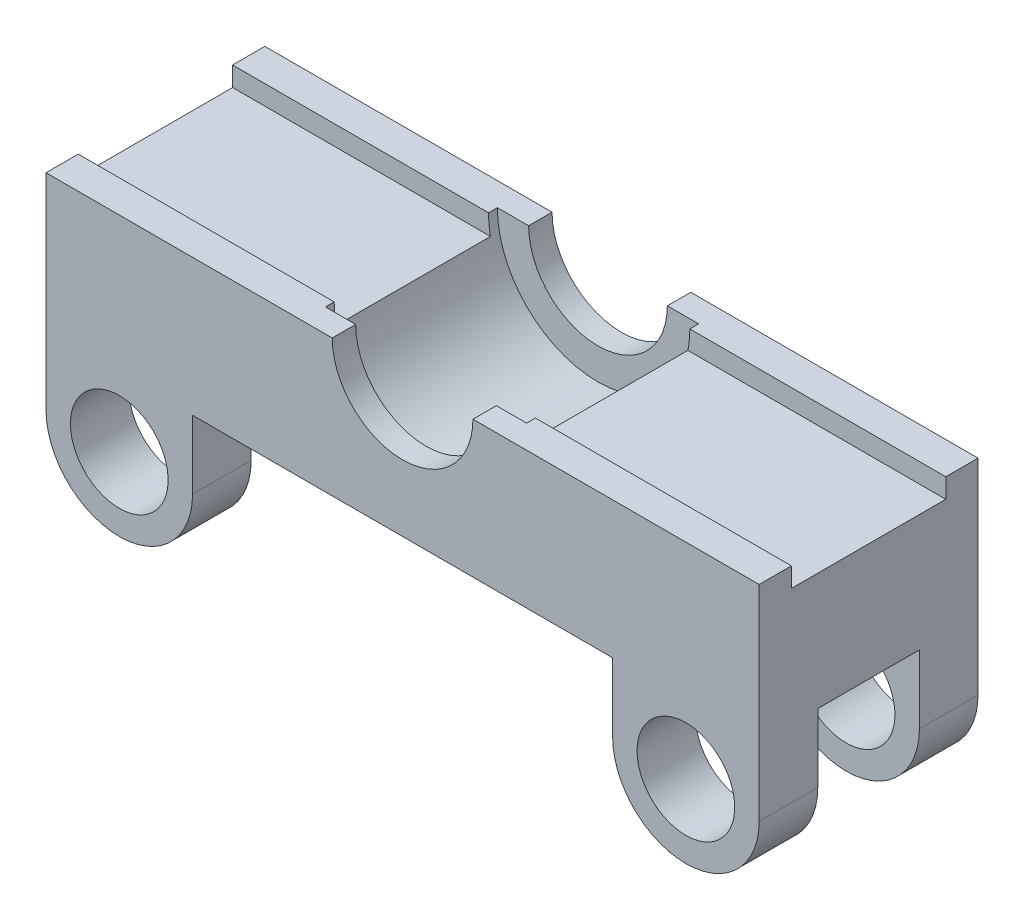
from build123d import *

# Parameters (mm, degrees)
ESQUISSE1_W                     = 36.5
ESQUISSE1_H                     = 7
BOSS_EXTRU_1_DEPTH              = 10
ESQUISSE2_R                     = 5.15
ENL_V_MAT_EXTRU_1_DEPTH         = 10
ESQUISSE3_W                     = 7.9
ESQUISSE3_H                     = 1
ENL_V_MAT_EXTRU_2_DEPTH         = 40
ESQUISSE5_W                     = 36.5
ESQUISSE5_H                     = 7
BOSS_EXTRU_2_DEPTH              = 1.2
ESQUISSE6_R                     = 3.55
ENL_V_MAT_EXTRU_3_DEPTH         = 10
ESQUISSE8_R                     = 2.5
BOSS_EXTRU_3_DEPTH              = 3
R_P_TITION_LIN_AIRE1_COUNT      = 2
R_P_TITION_LIN_AIRE1_PITCH      = 8.2
R_P_TITION_LIN_AIRE1_COUNT_DIR2 = 2
R_P_TITION_LIN_AIRE1_PITCH_DIR2 = 29
R_P_TITION_LIN_AIRE2_COUNT      = 2
R_P_TITION_LIN_AIRE2_PITCH      = 10
ESQUISSE10_R                    = 3.6
ENL_V_MAT_EXTRU_4_DEPTH         = 1.2
ESQUISSE11_W                    = 3.5
ESQUISSE11_H                    = 6.2
ENL_V_MAT_EXTRU_5_DEPTH         = 4
ENL_V_START                     = -2.5
ESQUISSE15_W                    = 3.75
ESQUISSE15_H                    = 2
ENL_V_MAT_EXTRU_7_DEPTH         = 5
ESQUISSE12_W                    = 13.5
ESQUISSE12_H                    = 6.2
ENL_V_MAT_EXTRU_6_DEPTH         = 1
CHANFREIN1_SIZE                 = 1.5


with BuildPart() as part:
    # Esquisse1 → Boss.-Extru.1 (new body)
    with BuildSketch(Plane.XY):
        with Locations((18.25, -3.5)):
            Rectangle(ESQUISSE1_W, ESQUISSE1_H)
    extrude(amount=BOSS_EXTRU_1_DEPTH)

    # Esquisse2 → Enlèv. mat.-Extru.1 (cut)
    with BuildSketch(Plane.XY.offset(10)):
        with Locations((18.25, 0)):
            Circle(ESQUISSE2_R)
    extrude(amount=-ENL_V_MAT_EXTRU_1_DEPTH, mode=Mode.SUBTRACT)

    # Esquisse3 → Enlèv. mat.-Extru.2 (cut)
    with BuildSketch(Plane.ZY):
        with Locations((4.4, -0.5)):
            Rectangle(ESQUISSE3_W, ESQUISSE3_H)
    extrude(amount=-ENL_V_MAT_EXTRU_2_DEPTH, mode=Mode.SUBTRACT)

    # Esquisse5 → Boss.-Extru.2 (add)
    with BuildSketch(Plane(origin=(0, 0, 0), x_dir=(-1, 0, 0), z_dir=(0, 0, -1))):
        with Locations((-18.25, -3.5)):
            Rectangle(ESQUISSE5_W, ESQUISSE5_H)
    boss_extru_2 = extrude(amount=BOSS_EXTRU_2_DEPTH)

    # Esquisse6 → Enlèv. mat.-Extru.3 (cut)
    with BuildSketch(Plane(origin=(0, 0, -1.2), x_dir=(-1, 0, 0), z_dir=(0, 0, -1))):
        with Locations((-18.25, 0)):
            Circle(ESQUISSE6_R)
    extrude(amount=-ENL_V_MAT_EXTRU_3_DEPTH, mode=Mode.SUBTRACT)

    # Esquisse8 → Boss.-Extru.3 (add)
    with BuildSketch(Plane(origin=(0, 0, -1.2), x_dir=(-1, 0, 0), z_dir=(0, 0, -1))):
        with BuildLine():
            Line((-36.5, -7), (-29, -7))
            Line((-29, -7), (-29, -10.5))
            ThreePointArc((-29, -10.5), (-32.75, -14.25), (-36.5, -10.5))
            Line((-36.5, -10.5), (-36.5, -7))
        make_face()
        with Locations((-32.75, -10.5)):
            Circle(ESQUISSE8_R, mode=Mode.SUBTRACT)
    boss_extru_3 = extrude(amount=-BOSS_EXTRU_3_DEPTH)

    # Répétition linéaire1: Boss.-Extru.3 2 × 2
    with Locations(*[(-j * R_P_TITION_LIN_AIRE1_PITCH_DIR2, 0, i * R_P_TITION_LIN_AIRE1_PITCH) for i in range(R_P_TITION_LIN_AIRE1_COUNT) for j in range(R_P_TITION_LIN_AIRE1_COUNT_DIR2) if (i, j) != (0, 0)]):
        add(boss_extru_3)

    # Répétition linéaire2: Boss.-Extru.2 ×2
    with Locations(*[(0, 0, i * R_P_TITION_LIN_AIRE2_PITCH) for i in range(1, R_P_TITION_LIN_AIRE2_COUNT)]):
        add(boss_extru_2)

    # Esquisse10 → Enlèv. mat.-Extru.4 (cut)
    with BuildSketch(Plane.XY.offset(10)):
        with Locations((18.25, 0)):
            Circle(ESQUISSE10_R)
    extrude(amount=-ENL_V_MAT_EXTRU_4_DEPTH, mode=Mode.SUBTRACT)

    # Esquisse11 → Enlèv. mat.-Extru.5 (cut)
    with BuildSketch(Plane.XZ.offset(7)):
        with Locations((9.75, 4.4)):
            Rectangle(ESQUISSE11_W, ESQUISSE11_H)
        with Locations((26.75, 4.4)):
            Rectangle(ESQUISSE11_W, ESQUISSE11_H)
    extrude(amount=-ENL_V_MAT_EXTRU_5_DEPTH, mode=Mode.SUBTRACT)

    # Esquisse15 → Enlèv. mat.-Extru.7 (cut)
    with BuildSketch(Plane(origin=(0, 0, -1.2), x_dir=(-1, 0, 0), z_dir=(0, 0, -1)).offset(ENL_V_START)):
        with Locations((-6.125, -4)):
            Rectangle(ESQUISSE15_W, ESQUISSE15_H)
        with Locations((-30.375, -4)):
            Rectangle(ESQUISSE15_W, ESQUISSE15_H)
    extrude(amount=-ENL_V_MAT_EXTRU_7_DEPTH, mode=Mode.SUBTRACT)

    # Esquisse12 → Enlèv. mat.-Extru.6 (cut)
    with BuildSketch(Plane(origin=(0, -7, 0), x_dir=(-1, 0, 0), z_dir=(0, -1, 0))):
        with Locations((-18.25, -4.4)):
            Rectangle(ESQUISSE12_W, ESQUISSE12_H)
    extrude(amount=-ENL_V_MAT_EXTRU_6_DEPTH, mode=Mode.SUBTRACT)

    # Chanfrein1
    chanfrein1_edges = [part.edges().sort_by_distance(p)[0] for p in [
        (8, -5, 3.8),
        (28.5, -5, 3.8),
        (11.5, -6, 4.4),
        (25, -6, 4.4),
    ]]
    chamfer(chanfrein1_edges, length=CHANFREIN1_SIZE)


solid = part.part
